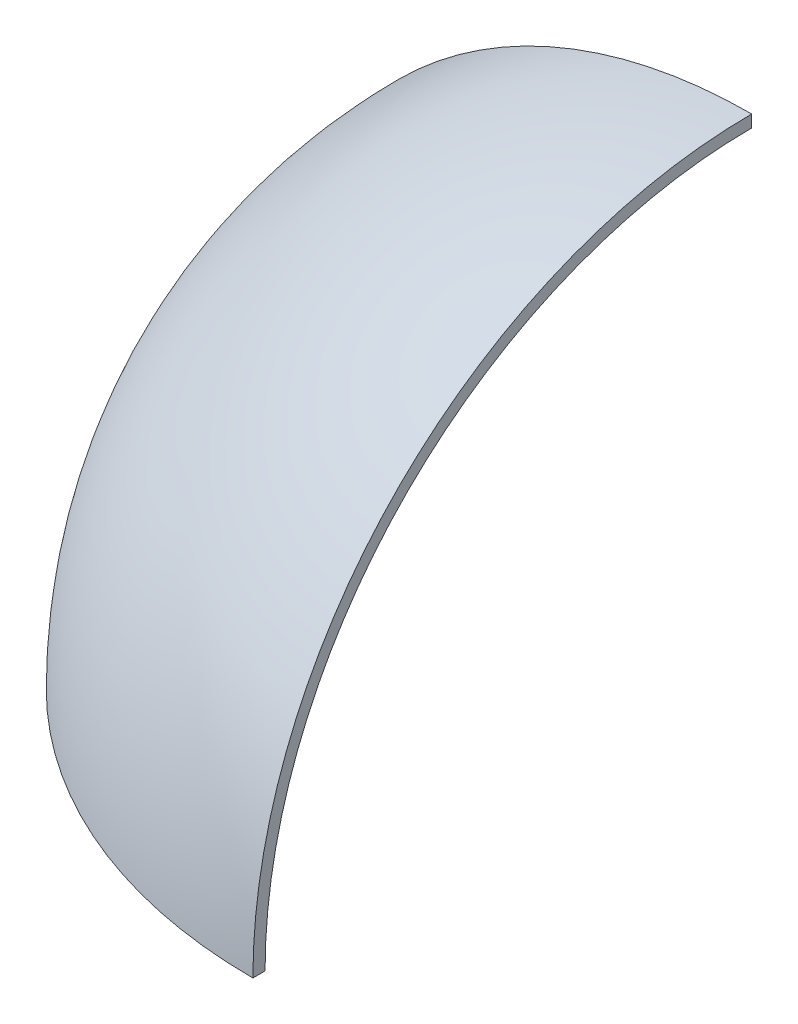
from build123d import *

# Parameters (mm, degrees)
REVOLVE_1_ANGLE = 90


with BuildPart() as part:
    # 草图2 → 旋转1 (revolve)
    with BuildSketch(Plane.XY):
        with BuildLine():
            Line((0, 40), (0, 41))
            ThreePointArc((0, 41), (-28.991378029, 28.991378029), (-41, 0))
            Line((-41, 0), (-40, 0))
            ThreePointArc((-40, 0), (-28.284271247, 28.284271247), (0, 40))
        make_face()
    revolve(axis=Axis((0, 40, 0), (0, 1, 0)), revolution_arc=REVOLVE_1_ANGLE)


solid = part.part
